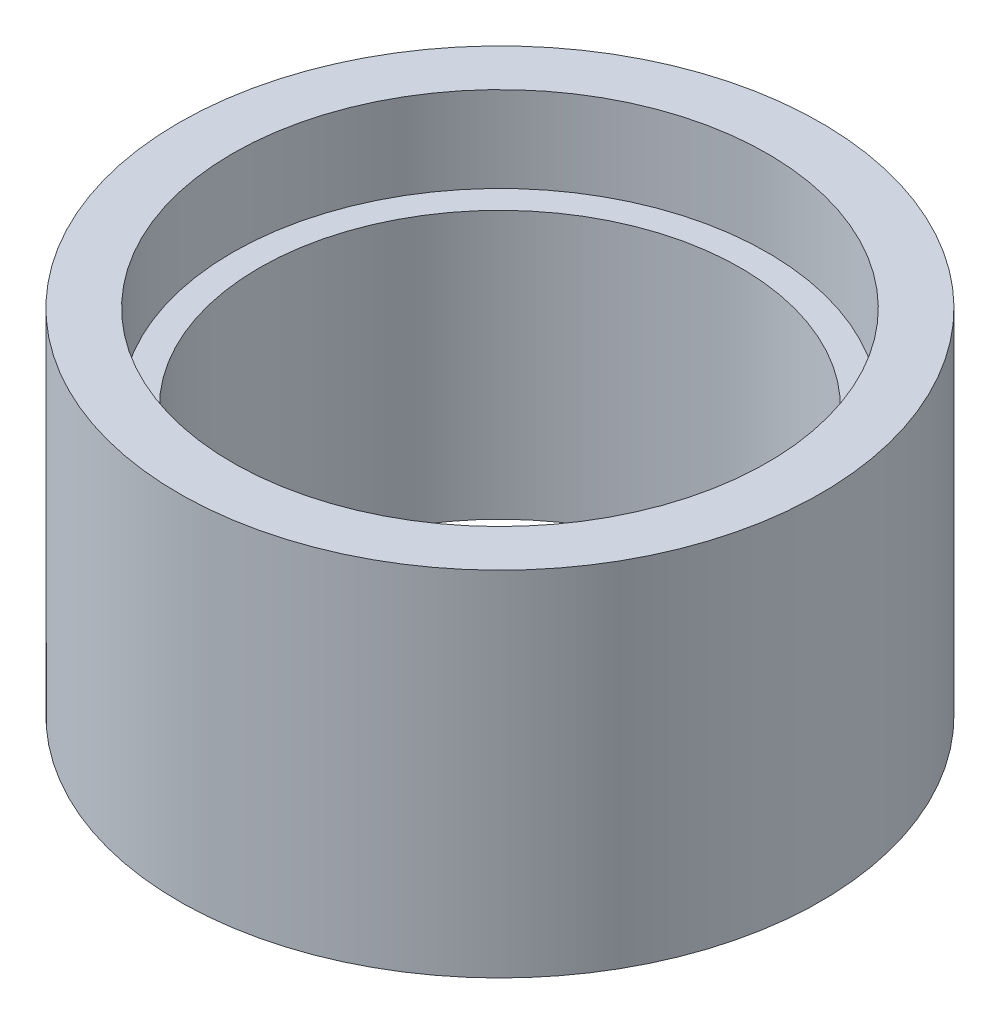
from build123d import *


with BuildPart() as part:
    # Sketch1 → Revolve1 (revolve)
    with BuildSketch(Plane.XY):
        Polygon((12, 0), (10, 0), (10, -3.2), (9, -3.2), (9, -13.2), (12, -13.2), align=None)
    revolve(axis=Axis((0, 0, 0), (0, -1, 0)))


solid = part.part
